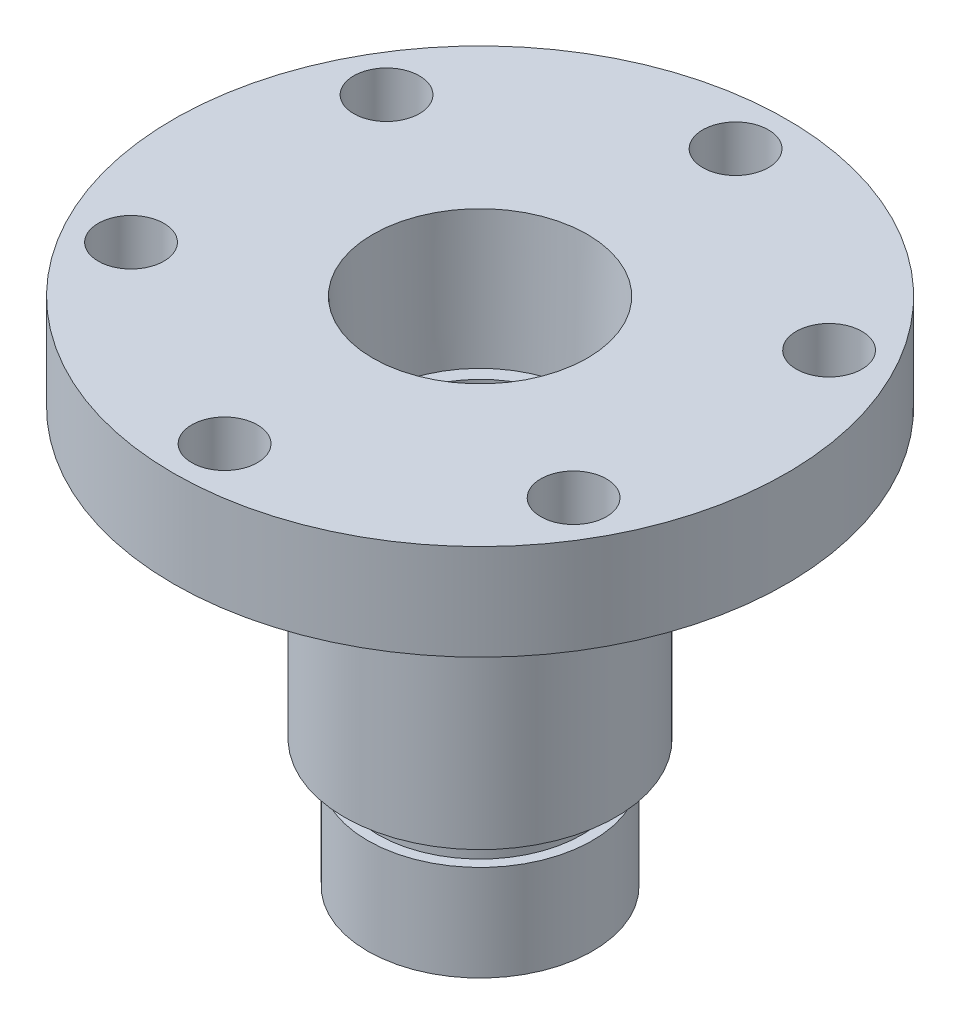
from build123d import *

# Parameters (mm, degrees)
F_1_4_CLEARANCE_HOLE1_D     = 6.5278
F_1_4_CLEARANCE_HOLE1_DEPTH = 22.606
F_1_4_CLEARANCE_HOLE1_TIP   = 1.961148974
CHAMFER1_SIZE               = 1


with BuildPart() as part:
    # Sketch1 → Revolve1 (revolve)
    with BuildSketch(Plane.XY, mode=Mode.PRIVATE) as revolve1_sk:
        Polygon((-7.5, 0), (-30.48, 0), (-30.48, -9.525), (-21, -9.525), (-21, -7.775), (-18, -7.775), (-18, -9.525), (-13.5, -9.525), (-13.5, -38.101219586), (-11, -38.101219586), (-11, -39.688719586), (-10.16, -39.688719586), (-10.16, -41.276219586), (-11.176, -41.276219586), (-11.176, -50.8), (-7.5, -50.8), align=None)
    revolve(revolve1_sk.sketch.rotate(Axis((0, 0, 0), (0, -1, 0)), 270), axis=Axis((0, 0, 0), (0, -1, 0)))

    # Sketch3 → 1/2 NPT Tapped Hole1 (revolve, cut)
    with BuildSketch(Plane(origin=(0, 0, 0), x_dir=(0, 0, 1), z_dir=(1, 0, 0))):
        Polygon((0, 0), (0, 27.970543693), (8.9281, 22.606), (8.9281, 13.462), (10.261665792, 13.462), (10.6647361, 0), align=None)
    revolve(axis=Axis((0, 6.35, 0), (0, -1, 0)), mode=Mode.SUBTRACT)

    # 1/4 Clearance Hole1
    with Locations(Plane(origin=(0, 0, 0), x_dir=(1, 0, 0), z_dir=(0, 1, 0))):
        with Locations((21.997045256, 12.7), (0, 25.4), (-21.997045256, 12.7), (-21.997045256, -12.7), (0, -25.4), (21.997045256, -12.7)):
            Hole(F_1_4_CLEARANCE_HOLE1_D / 2, depth=F_1_4_CLEARANCE_HOLE1_DEPTH)
            with Locations((0, 0, -(F_1_4_CLEARANCE_HOLE1_DEPTH + F_1_4_CLEARANCE_HOLE1_TIP / 2))):  # 118° drill point
                Cone(0, F_1_4_CLEARANCE_HOLE1_D / 2, F_1_4_CLEARANCE_HOLE1_TIP, mode=Mode.SUBTRACT)

    # Chamfer1
    chamfer1_edges = [part.edges().sort_by_distance(p)[0] for p in [
        (0, -9.525, -13.5),
    ]]
    chamfer(chamfer1_edges, length=CHAMFER1_SIZE)


solid = part.part
